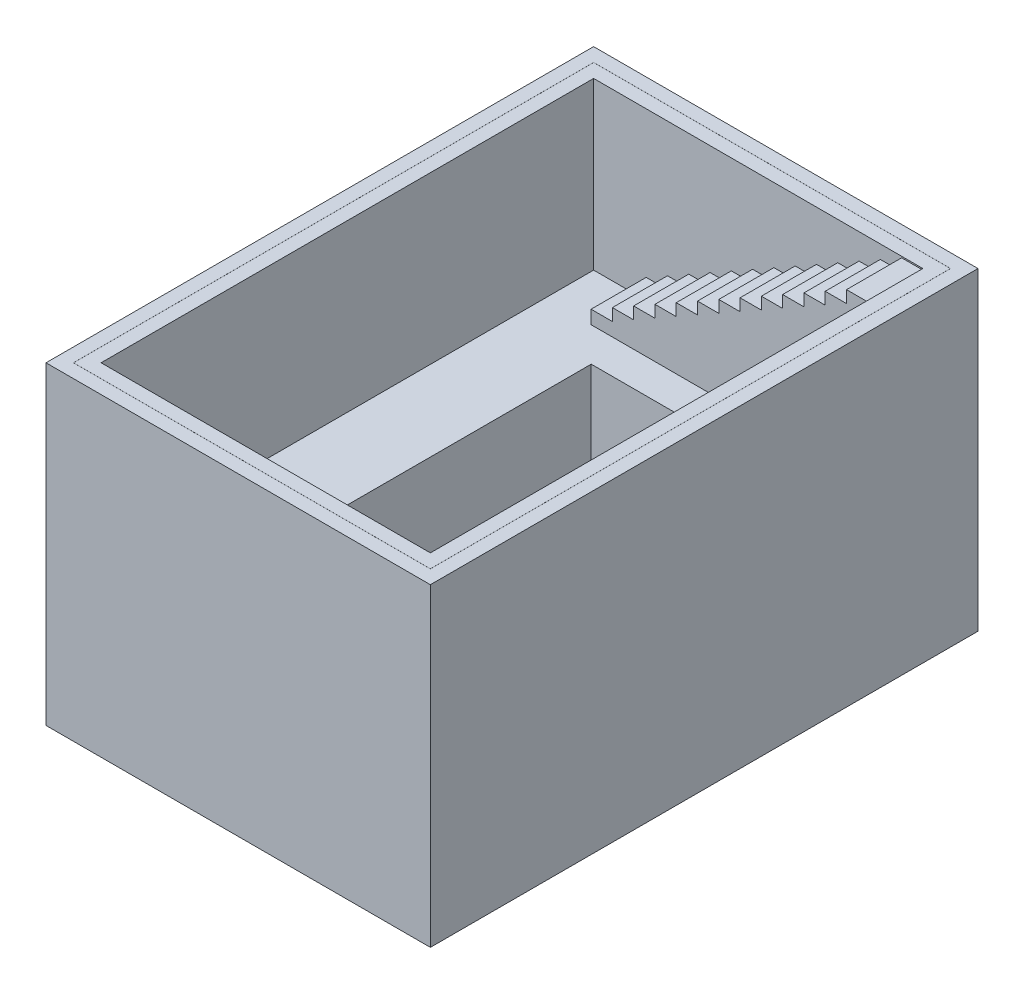
from build123d import *

# Parameters (mm, degrees)
CROQUIS1_W              = 5180
CROQUIS1_H              = 7550
CROQUIS1_W_2            = 4780
CROQUIS1_H_2            = 7150
SALIENTE_EXTRUIR1_DEPTH = 4560
SALIENTE_EXTRUIR2_DEPTH = 800
CROQUIS3_W              = 4780
CROQUIS3_H              = 7150
CROQUIS3_W_2            = 2450
CROQUIS3_H_2            = 4750
SALIENTE_EXTRUIR3_DEPTH = 2150
CROQUIS4_W              = 5580
CROQUIS4_H              = 7950
CROQUIS4_W_2            = 5182
CROQUIS4_H_2            = 7552
SALIENTE_EXTRUIR4_DEPTH = 4560


with BuildPart() as part:
    # Croquis1 → Saliente-Extruir1 (new body)
    with BuildSketch(Plane(origin=(0, 0, 0), x_dir=(1, 0, 0), z_dir=(0, 1, 0))):
        Rectangle(CROQUIS1_W, CROQUIS1_H)
        Rectangle(CROQUIS1_W_2, CROQUIS1_H_2, mode=Mode.SUBTRACT)
    extrude(amount=SALIENTE_EXTRUIR1_DEPTH)

    # Croquis2 → Saliente-Extruir2 (add)
    with BuildSketch(Plane.XY.offset(-3575)):
        Polygon((2390, 4540), (2081, 4540), (2081, 4365), (1772, 4365), (1772, 4190), (1463, 4190), (1463, 4015), (1154, 4015), (1154, 3840), (845, 3840), (845, 3665), (536, 3665), (536, 3490), (227, 3490), (227, 3315), (-82, 3315), (-82, 3140), (-391, 3140), (-391, 2965), (-700, 2965), (-700, 2790), (-1009, 2790), (-1009, 2615), (-1318, 2615), (-1318, 2440), (-1627, 2440), (-1627, 2245), (2390, 2245), align=None)
    extrude(amount=SALIENTE_EXTRUIR2_DEPTH)

    # Croquis3 → Saliente-Extruir3 (add)
    with BuildSketch(Plane(origin=(0, 0, 0), x_dir=(1, 0, 0), z_dir=(0, 1, 0))):
        Rectangle(CROQUIS3_W, CROQUIS3_H)
        Rectangle(CROQUIS3_W_2, CROQUIS3_H_2, mode=Mode.SUBTRACT)
    extrude(amount=SALIENTE_EXTRUIR3_DEPTH)


with BuildPart() as body_2:
    # Croquis4 → Saliente-Extruir4 (new body)
    with BuildSketch(Plane(origin=(0, 4560, 0), x_dir=(1, 0, 0), z_dir=(0, 1, 0))):
        Rectangle(CROQUIS4_W, CROQUIS4_H)
        Rectangle(CROQUIS4_W_2, CROQUIS4_H_2, mode=Mode.SUBTRACT)
    extrude(amount=-SALIENTE_EXTRUIR4_DEPTH)


solid = Compound([part.part, body_2.part])
